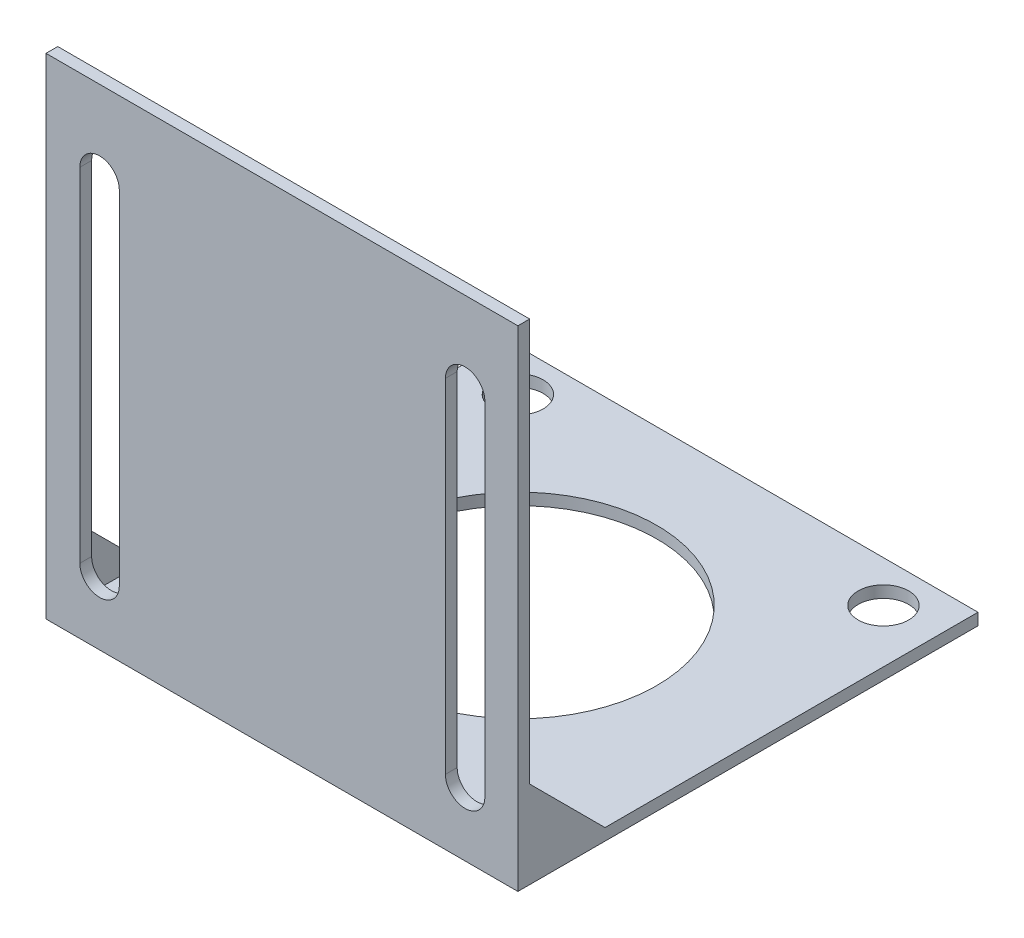
from build123d import *

# Parameters (mm, degrees)
SKETCH1_W           = 30.2180244
SKETCH1_H           = 30.2180244
SKETCH1_R           = 9.3599
SKETCH1_R_2         = 1.7018
BOSS_EXTRUDE1_DEPTH = 0.79375
SKETCH2_W           = 30.2180244
SKETCH2_H           = 33.02
BOSS_EXTRUDE2_DEPTH = 0.79375
BOSS_EXTRUDE3_DEPTH = 0.79375
BOSS_EXTRUDE4_DEPTH = 0.79375
CUT_EXTRUDE1_DEPTH  = 55.453462241


with BuildPart() as part:
    # Sketch1 → Boss-Extrude1 (new body)
    with BuildSketch(Plane(origin=(0, 0, 0), x_dir=(1, 0, 0), z_dir=(0, 1, 0))):
        with Locations((15.1090122, -15.1090122)):
            Rectangle(SKETCH1_W, SKETCH1_H)
        with Locations(Location((15.1090122, -15.1090122, 0), (0, 0, 270))):
            Circle(SKETCH1_R, mode=Mode.SUBTRACT)
        with Locations(Location((2.7900122, -2.7900122, 0), (0, 0, 270))):
            Circle(SKETCH1_R_2, mode=Mode.SUBTRACT)
        with Locations(Location((27.4280122, -2.7900122, 0), (0, 0, 270))):
            Circle(SKETCH1_R_2, mode=Mode.SUBTRACT)
        with Locations(Location((27.4280122, -27.4280122, 0), (0, 0, 270))):
            Circle(SKETCH1_R_2, mode=Mode.SUBTRACT)
        with Locations(Location((2.7900122, -27.4280122, 0), (0, 0, 270))):
            Circle(SKETCH1_R_2, mode=Mode.SUBTRACT)
    extrude(amount=BOSS_EXTRUDE1_DEPTH)

    # Sketch2 → Boss-Extrude2 (add)
    with BuildSketch(Plane.XY.offset(30.2180244)):
        with Locations((15.1090122, 16.51)):
            Rectangle(SKETCH2_W, SKETCH2_H)
    extrude(amount=BOSS_EXTRUDE2_DEPTH)

    # Sketch3 → Boss-Extrude3 (add)
    with BuildSketch(Plane(origin=(30.2180244, 0, 0), x_dir=(0, 0, -1), z_dir=(1, 0, 0))):
        Polygon((-25.1380244, 0.79375), (-30.2180244, 5.87375), (-30.2180244, 33.02), (-31.0117744, 33.02), (-31.0117744, 0), (0, 0), (0, 0.79375), align=None)
    extrude(amount=BOSS_EXTRUDE3_DEPTH)

    # Sketch4 → Boss-Extrude4 (add)
    with BuildSketch(Plane.ZY):
        Polygon((25.1380244, 0.79375), (30.2180244, 5.87375), (30.2180244, 33.02), (31.0117744, 33.02), (31.0117744, 0), (0, 0), (0, 0.79375), align=None)
    extrude(amount=BOSS_EXTRUDE4_DEPTH)

    # Sketch5 → Cut-Extrude1 (cut, through all)
    with BuildSketch(Plane(origin=(0, 0, 30.2180244), x_dir=(-1, 0, 0), z_dir=(0, 0, -1))):
        with BuildLine():
            Line((-4.147269761, 4.395528514), (-4.147269761, 27.509830099))
            ThreePointArc((-4.147269761, 27.509830099), (-2.8177744, 28.83932546), (-1.488279039, 27.509830099))
            Line((-1.488279039, 27.509830099), (-1.488279039, 4.395528514))
            ThreePointArc((-1.488279039, 4.395528514), (-2.8177744, 3.066033153), (-4.147269761, 4.395528514))
        make_face()
        with BuildLine():
            Line((-28.785269761, 4.395528514), (-28.785269761, 27.509830099))
            ThreePointArc((-28.785269761, 27.509830099), (-27.4557744, 28.83932546), (-26.126279039, 27.509830099))
            Line((-26.126279039, 27.509830099), (-26.126279039, 4.395528514))
            ThreePointArc((-26.126279039, 4.395528514), (-27.4557744, 3.066033153), (-28.785269761, 4.395528514))
        make_face()
    extrude(amount=-CUT_EXTRUDE1_DEPTH, mode=Mode.SUBTRACT)


solid = part.part
